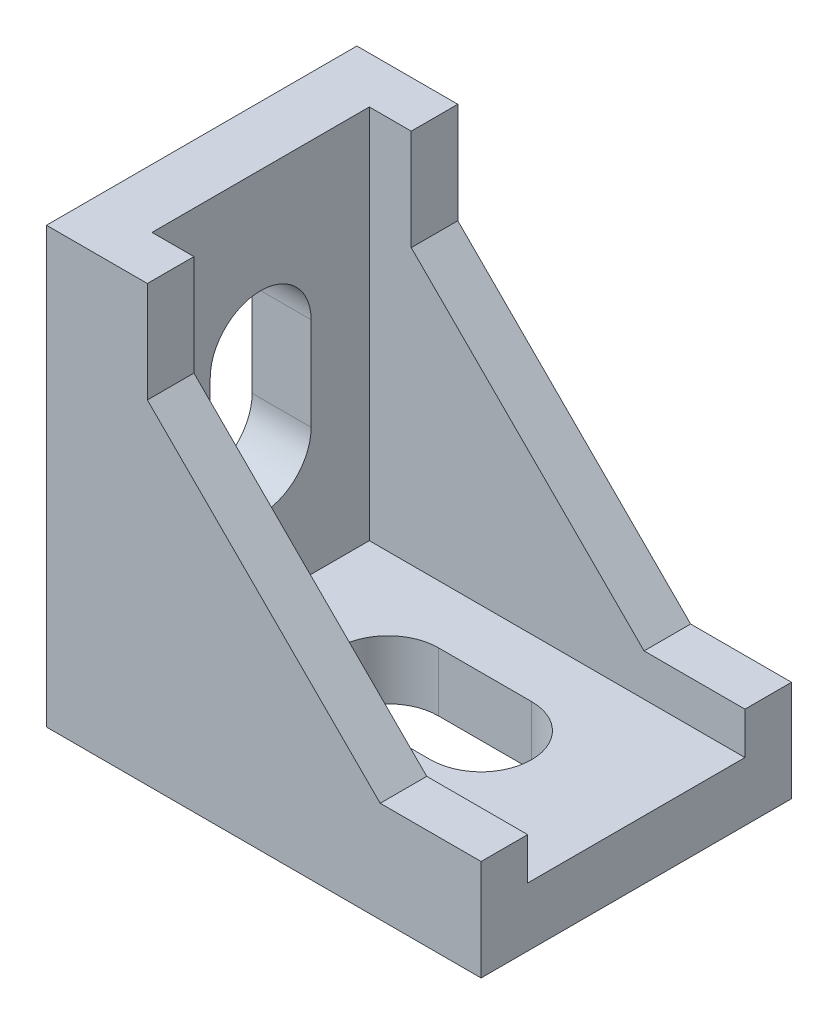
from build123d import *

# Parameters (mm, degrees)
EXTRUDE_3_DEPTH      = 20
SKETCH_8_W           = 14
SKETCH_8_H           = 24.2
CUT_EXTRUDE_5_DEPTH  = 24.2
CUT_EXTRUDE_6_DEPTH  = 43.067089274
CUT_EXTRUDE_7_DEPTH  = 43.067089274
EXTRUDE_4_DEPTH      = 2.7
EXTRUDE_4_DEPTH_BACK = 2.7
SKETCH_11_W          = 2
SKETCH_11_H          = 2


with BuildPart() as part:
    # 草图7 → 凸台-拉伸3 (new body)
    with BuildSketch(Plane.XY):
        Polygon((0, 0), (0, 28), (6.5, 28), (6.5, 21.5), (21.5, 6.5), (28, 6.5), (28, 0), align=None)
    extrude(amount=EXTRUDE_3_DEPTH)

    # 草图8 → 切除-拉伸5 (cut)
    with BuildSketch(Plane(origin=(28, 0, 0), x_dir=(0, 0, -1), z_dir=(1, 0, 0))):
        with Locations((-10, 15.9)):
            Rectangle(SKETCH_8_W, SKETCH_8_H)
    extrude(amount=-CUT_EXTRUDE_5_DEPTH, mode=Mode.SUBTRACT)

    # 草图9 → 切除-拉伸6 (cut, through all)
    with BuildSketch(Plane(origin=(3.8, 0, 0), x_dir=(0, 0, -1), z_dir=(1, 0, 0))):
        with BuildLine():
            Line((-6.75, 18), (-6.75, 12))
            ThreePointArc((-6.75, 12), (-10, 8.75), (-13.25, 12))
            Line((-13.25, 12), (-13.25, 18))
            ThreePointArc((-13.25, 18), (-10, 21.25), (-6.75, 18))
        make_face()
    extrude(amount=-CUT_EXTRUDE_6_DEPTH, mode=Mode.SUBTRACT)

    # 草图10 → 切除-拉伸7 (cut, through all)
    with BuildSketch(Plane(origin=(0, 3.8, 0), x_dir=(1, 0, 0), z_dir=(0, 1, 0))):
        with BuildLine():
            Line((12, -6.75), (18, -6.75))
            ThreePointArc((18, -6.75), (21.25, -10), (18, -13.25))
            Line((18, -13.25), (12, -13.25))
            ThreePointArc((12, -13.25), (8.75, -10), (12, -6.75))
        make_face()
    extrude(amount=-CUT_EXTRUDE_7_DEPTH, mode=Mode.SUBTRACT)

    # 草图11 → 凸台-拉伸4 (add, two sides: drawn at the far end of the back side and taken through both)
    with BuildSketch(Plane.XY.offset(10).offset(-EXTRUDE_4_DEPTH_BACK)):
        with Locations((4.5, -1)):
            Rectangle(SKETCH_11_W, SKETCH_11_H)
        with Locations((23.5, -1)):
            Rectangle(SKETCH_11_W, SKETCH_11_H)
        with Locations((-1, 23.5)):
            Rectangle(SKETCH_11_W, SKETCH_11_H)
        with Locations((-1, 4.5)):
            Rectangle(SKETCH_11_W, SKETCH_11_H)
    extrude(amount=EXTRUDE_4_DEPTH + EXTRUDE_4_DEPTH_BACK)


solid = part.part
